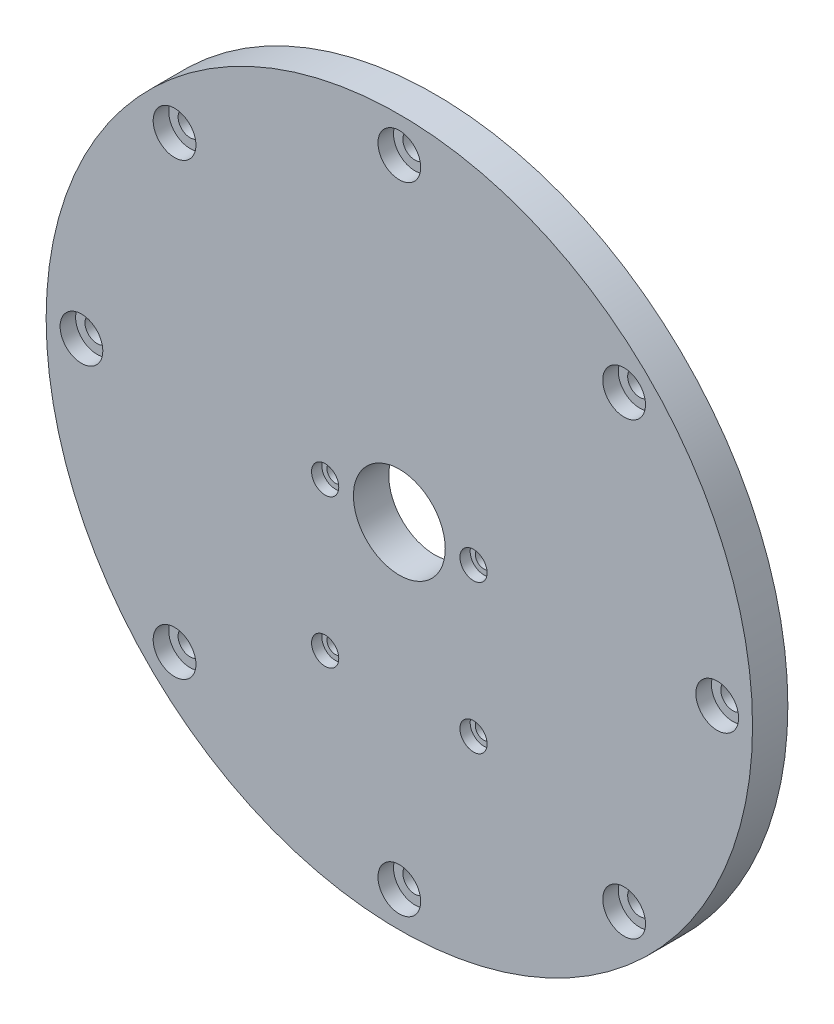
from build123d import *

# Parameters (mm, degrees)
SKETCH_1_R                   = 50
EXTRUDE_1_DEPTH              = 5
HOLE_WIZARD_M2_1_D           = 2.4
HOLE_WIZARD_M2_1_CBORE_D     = 3.85
HOLE_WIZARD_M2_1_CBORE_DEPTH = 1.45
HOLE_WIZARD_M3_2_D           = 3.4
HOLE_WIZARD_M3_2_CBORE_D     = 6.05
HOLE_WIZARD_M3_2_CBORE_DEPTH = 2.2
PATTERN_CIRCULAR_1_COUNT     = 8
SKETCH_6_R                   = 6.5
CUT_EXTRUDE_1_DEPTH          = 71.887234394


with BuildPart() as part:
    # ｽｹｯﾁ1 → ﾎﾞｽ - 押し出し1 (new body)
    with BuildSketch(Plane.XY):
        Circle(SKETCH_1_R)
    extrude(amount=EXTRUDE_1_DEPTH)

    # M2 丸平ねじ用座ぐり穴1 (through all)
    with Locations(Plane.XY.offset(5)):
        with Locations((-10.5, 0), (-10.5, -21)):
            hole_wizard_m2_1 = CounterBoreHole(HOLE_WIZARD_M2_1_D / 2, HOLE_WIZARD_M2_1_CBORE_D / 2, HOLE_WIZARD_M2_1_CBORE_DEPTH)

    # ﾐﾗｰ1: M2 丸平ねじ用座ぐり穴1 across plane
    add(hole_wizard_m2_1.mirror(Plane(origin=(0, 0, 0), x_dir=(0, 0, 1), z_dir=(1, 0, 0))), mode=Mode.SUBTRACT)

    # M3 丸平ねじ用座ぐり穴2 (through all)
    with Locations(Plane.XY.offset(5)):
        with Locations((45, 0)):
            hole_wizard_m3_2 = CounterBoreHole(HOLE_WIZARD_M3_2_D / 2, HOLE_WIZARD_M3_2_CBORE_D / 2, HOLE_WIZARD_M3_2_CBORE_DEPTH)

    # 円形ﾊﾟﾀｰﾝ1: M3 丸平ねじ用座ぐり穴2 ×8 about axis
    pattern_circular_1_axis = Axis((0, 0, 0), (0, 0, 1))
    for i in range(1, PATTERN_CIRCULAR_1_COUNT):
        add(hole_wizard_m3_2.rotate(pattern_circular_1_axis, i * 360 / PATTERN_CIRCULAR_1_COUNT), mode=Mode.SUBTRACT)

    # ｽｹｯﾁ6 → ｶｯﾄ - 押し出し1 (cut, through all)
    with BuildSketch(Plane.XY.offset(5)):
        Circle(SKETCH_6_R)
    extrude(amount=-CUT_EXTRUDE_1_DEPTH, mode=Mode.SUBTRACT)


solid = part.part
